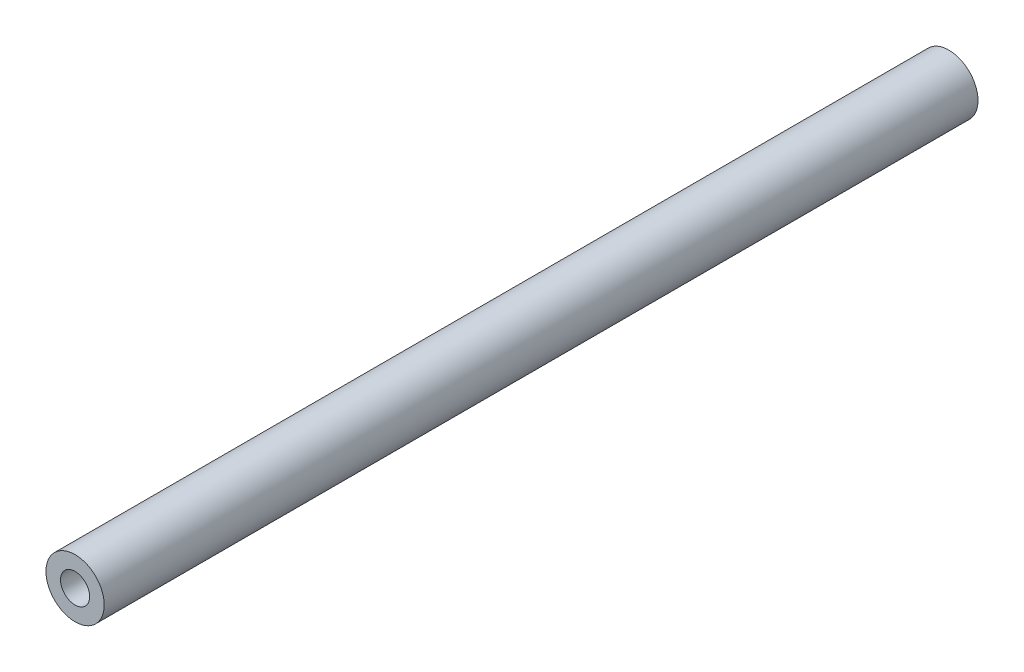
from build123d import *

# Parameters (mm, degrees)
SKETCH_4_R      = 2
SKETCH_4_R_2    = 1
EXTRUDE_1_DEPTH = 60


with BuildPart() as part:
    # 스케치4 → 보스-돌출1 (new body)
    with BuildSketch(Plane.XY):
        Circle(SKETCH_4_R)
        Circle(SKETCH_4_R_2, mode=Mode.SUBTRACT)
    extrude(amount=EXTRUDE_1_DEPTH)


solid = part.part
